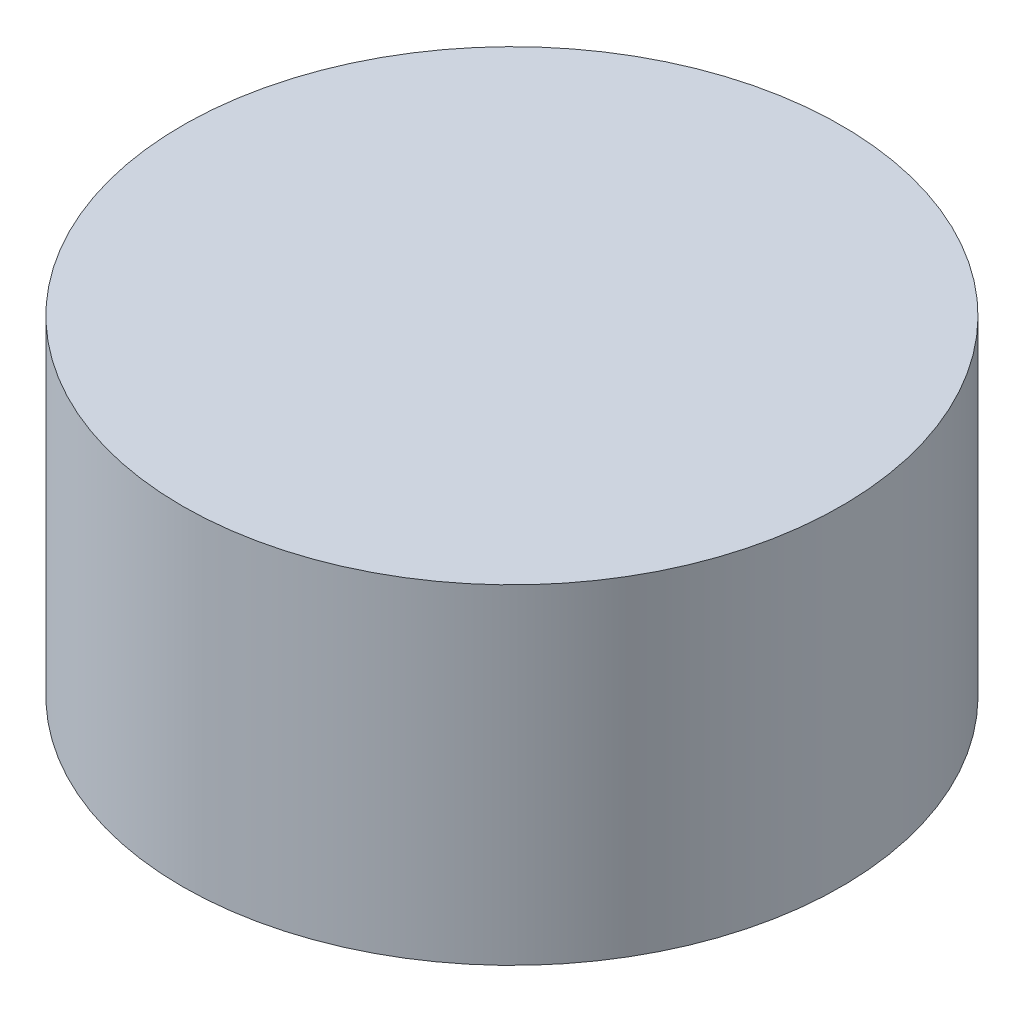
from build123d import *

# Parameters (mm, degrees)
BASE_W = 0.5
BASE_H = 0.5


with BuildPart() as part:
    # base → rev (revolve)
    with BuildSketch(Plane.XY, mode=Mode.PRIVATE) as rev_sk:
        with Locations((0.25, -1.984467265)):
            Rectangle(BASE_W, BASE_H)
    revolve(rev_sk.sketch.rotate(Axis((0, 0.774496622, 0), (0, -1, 0)), 90), axis=Axis((0, 0.774496622, 0), (0, -1, 0)))


solid = part.part
